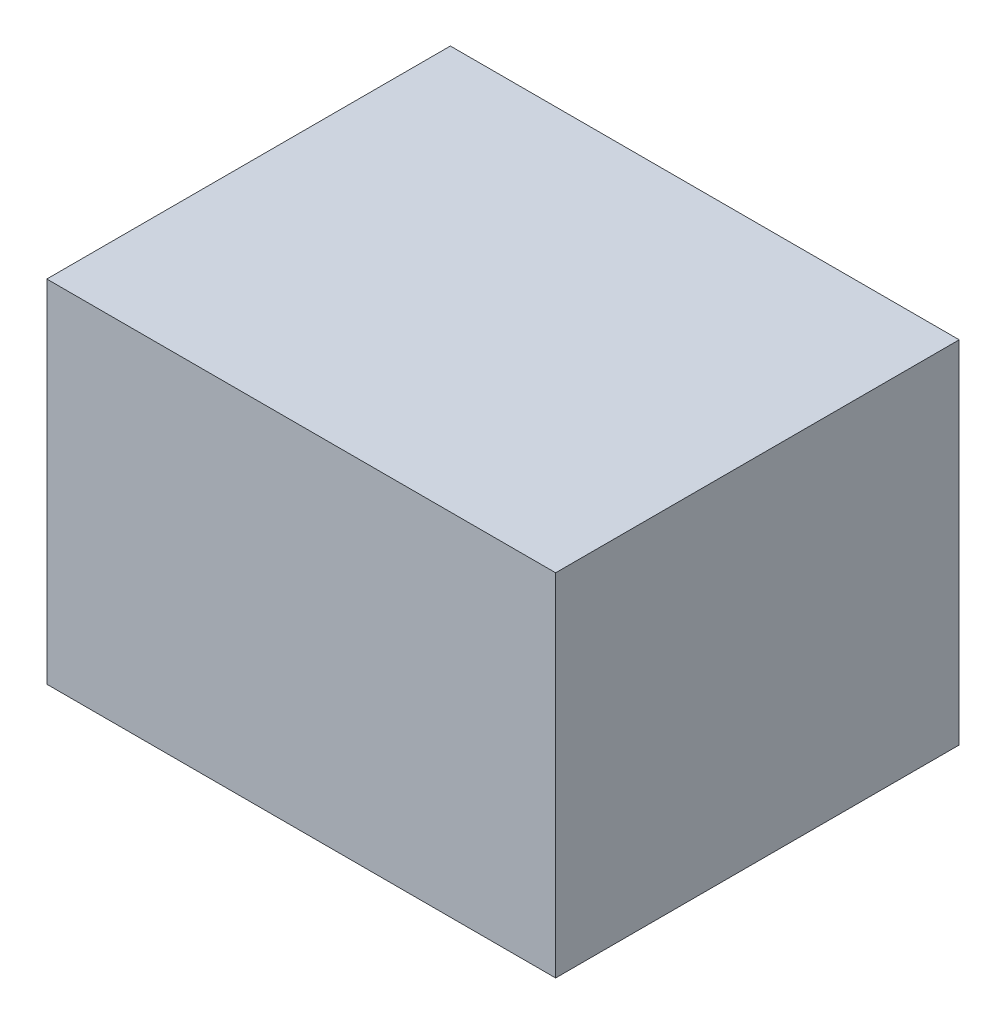
from build123d import *

# Parameters (mm, degrees)
SKETCH_1_W      = 290
SKETCH_1_H      = 230
EXTRUDE_1_DEPTH = 200


with BuildPart() as part:
    # 草图1 → 凸台-拉伸1 (new body)
    with BuildSketch(Plane(origin=(0, 0, 0), x_dir=(1, 0, 0), z_dir=(0, 1, 0))):
        Rectangle(SKETCH_1_W, SKETCH_1_H)
    extrude(amount=EXTRUDE_1_DEPTH)


solid = part.part
